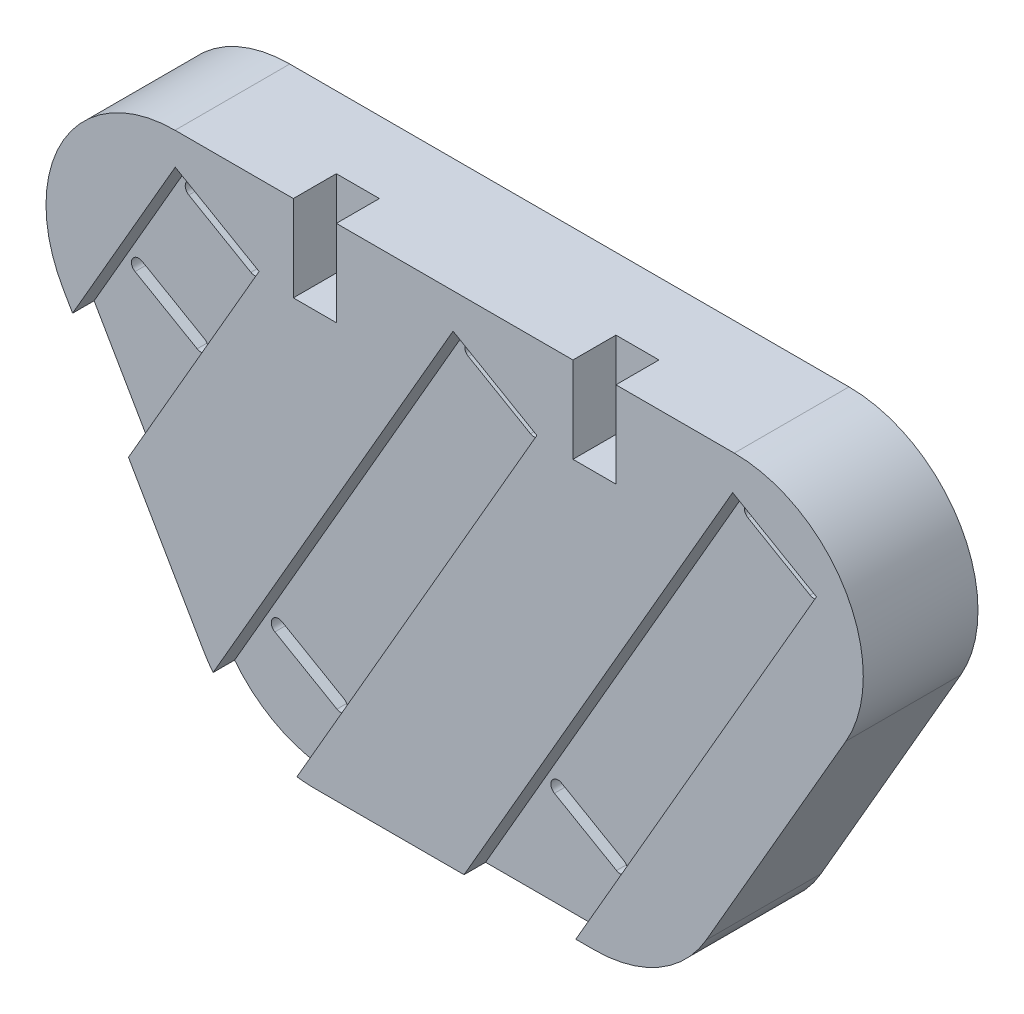
from build123d import *

# Parameters (mm, degrees)
SKETCH1_R           = 7.5
BOSS_EXTRUDE1_DEPTH = 5
SKETCH2_R           = 7.5
BOSS_EXTRUDE2_DEPTH = 1.5
BOSS_EXTRUDE3_DEPTH = 1.5
SKETCH9_W           = 3
SKETCH9_H           = 6
CUT_EXTRUDE4_DEPTH  = 3
SKETCH4_W           = 5
SKETCH4_H           = 1.5
CUT_EXTRUDE5_DEPTH  = 3


with BuildPart() as part:
    # Sketch1 → Boss-Extrude1 (new body)
    with BuildSketch(Plane.XY):
        with BuildLine():
            Line((7.794228634, -4.5), (-1.955771366, -21.387495374))
            ThreePointArc((-1.955771366, -21.387495374), (-5.25, -24.681724008), (-9.75, -25.887495374))
            Line((-9.75, -25.887495374), (-29.25, -25.887495374))
            ThreePointArc((-29.25, -25.887495374), (-33.75, -24.681724008), (-37.044228634, -21.387495374))
            Line((-37.044228634, -21.387495374), (-46.794228634, -4.5))
            ThreePointArc((-46.794228634, -4.5), (-46.794228634, 4.5), (-39, 9))
            Line((-39, 9), (0, 9))
            ThreePointArc((0, 9), (7.794228634, 4.5), (7.794228634, -4.5))
        make_face()
        with Locations((-29.25, -16.887495374)):
            Circle(SKETCH1_R, mode=Mode.SUBTRACT)
        with Locations((-19.5, 0)):
            Circle(SKETCH1_R, mode=Mode.SUBTRACT)
        Circle(SKETCH1_R, mode=Mode.SUBTRACT)
        with Locations((-9.75, -16.887495374)):
            Circle(SKETCH1_R, mode=Mode.SUBTRACT)
        with Locations((-39, 0)):
            Circle(SKETCH1_R, mode=Mode.SUBTRACT)
    extrude(amount=BOSS_EXTRUDE1_DEPTH)

    # Sketch2 → Boss-Extrude2 (add)
    # profile 1 of 6: a face of its own
    with BuildSketch(Plane.XY.offset(5)):
        with BuildLine():
            Line((-1.955771366, -21.387495374), (7.794228634, -4.5))
            ThreePointArc((7.794228634, -4.5), (7.794228634, 4.5), (0, 9))
            Line((0, 9), (-39, 9))
            ThreePointArc((-39, 9), (-46.794228634, 4.5), (-46.794228634, -4.5))
            Line((-46.794228634, -4.5), (-37.044228634, -21.387495374))
            ThreePointArc((-37.044228634, -21.387495374), (-33.75, -24.681724008), (-29.25, -25.887495374))
            Line((-29.25, -25.887495374), (-9.75, -25.887495374))
            ThreePointArc((-9.75, -25.887495374), (-5.25, -24.681724008), (-1.955771366, -21.387495374))
        make_face()
        Circle(SKETCH2_R, mode=Mode.SUBTRACT)
        with Locations((-19.5, 0)):
            Circle(SKETCH2_R, mode=Mode.SUBTRACT)
        with Locations((-39, 0)):
            Circle(SKETCH2_R, mode=Mode.SUBTRACT)
        with Locations((-29.25, -16.887495374)):
            Circle(SKETCH2_R, mode=Mode.SUBTRACT)
        with Locations((-9.75, -16.887495374)):
            Circle(SKETCH2_R, mode=Mode.SUBTRACT)
    # profile 2 of 6: a face of its own
    with BuildSketch(Plane.XY.offset(5)):
        with Locations((-9.75, -16.887495374)):
            Circle(SKETCH2_R)
        with BuildLine():
            ThreePointArc((-13.540063509, -18.452077936), (-14.223076211, -18.635090638), (-14.040063509, -19.31810334))
            Line((-14.040063509, -19.31810334), (-9.709936491, -21.81810334))
            ThreePointArc((-9.709936491, -21.81810334), (-9.026923789, -21.635090638), (-9.209936491, -20.952077936))
            Line((-9.209936491, -20.952077936), (-13.540063509, -18.452077936))
        make_face(mode=Mode.SUBTRACT)
    # profile 3 of 6: a face of its own
    with BuildSketch(Plane.XY.offset(5)):
        Circle(SKETCH2_R)
        with BuildLine():
            ThreePointArc((-0.040063509, 4.930607966), (-0.723076211, 4.747595264), (-0.540063509, 4.064582562))
            Line((-0.540063509, 4.064582562), (3.790063509, 1.564582562))
            ThreePointArc((3.790063509, 1.564582562), (4.473076211, 1.747595264), (4.290063509, 2.430607966))
            Line((4.290063509, 2.430607966), (-0.040063509, 4.930607966))
        make_face(mode=Mode.SUBTRACT)
    # profile 4 of 6: a face of its own
    with BuildSketch(Plane.XY.offset(5)):
        with Locations((-19.5, 0)):
            Circle(SKETCH2_R)
        with BuildLine():
            ThreePointArc((-19.540063509, 4.930607966), (-20.223076211, 4.747595264), (-20.040063509, 4.064582562))
            Line((-20.040063509, 4.064582562), (-15.709936491, 1.564582562))
            ThreePointArc((-15.709936491, 1.564582562), (-15.026923789, 1.747595264), (-15.209936491, 2.430607966))
            Line((-15.209936491, 2.430607966), (-19.540063509, 4.930607966))
        make_face(mode=Mode.SUBTRACT)
    # profile 5 of 6: a face of its own
    with BuildSketch(Plane.XY.offset(5)):
        with Locations((-29.25, -16.887495374)):
            Circle(SKETCH2_R)
        with BuildLine():
            ThreePointArc((-33.040063509, -18.452077936), (-33.723076211, -18.635090638), (-33.540063509, -19.31810334))
            Line((-33.540063509, -19.31810334), (-29.209936491, -21.81810334))
            ThreePointArc((-29.209936491, -21.81810334), (-28.526923789, -21.635090638), (-28.709936491, -20.952077936))
            Line((-28.709936491, -20.952077936), (-33.040063509, -18.452077936))
        make_face(mode=Mode.SUBTRACT)
    # profile 6 of 6: a face of its own
    with BuildSketch(Plane.XY.offset(5)):
        with Locations((-39, 0)):
            Circle(SKETCH2_R)
        with BuildLine():
            ThreePointArc((-42.790063509, -1.564582562), (-43.473076211, -1.747595264), (-43.290063509, -2.430607966))
            Line((-43.290063509, -2.430607966), (-38.959936491, -4.930607966))
            ThreePointArc((-38.959936491, -4.930607966), (-38.276923789, -4.747595264), (-38.459936491, -4.064582562))
            Line((-38.459936491, -4.064582562), (-42.790063509, -1.564582562))
        make_face(mode=Mode.SUBTRACT)
        with BuildLine():
            ThreePointArc((-39.040063509, 4.930607966), (-39.723076211, 4.747595264), (-39.540063509, 4.064582562))
            Line((-39.540063509, 4.064582562), (-35.209936491, 1.564582562))
            ThreePointArc((-35.209936491, 1.564582562), (-34.526923789, 1.747595264), (-34.709936491, 2.430607966))
            Line((-34.709936491, 2.430607966), (-39.040063509, 4.930607966))
        make_face(mode=Mode.SUBTRACT)
    extrude(amount=BOSS_EXTRUDE2_DEPTH)

    # Sketch3 → Boss-Extrude3 (add)
    with BuildSketch(Plane.XY.offset(6.5)):
        with BuildLine():
            ThreePointArc((-39, 9), (-46.794228634, 4.5), (-46.794228634, -4.5))
            Line((-46.794228634, -4.5), (-46.144709581, -5.625))
            Line((-46.144709581, -5.625), (-38.985335738, 6.775399247))
            Line((-38.985335738, 6.775399247), (-33.139664262, 3.400399247))
            Line((-33.139664262, 3.400399247), (-42.247595264, -12.375))
            Line((-42.247595264, -12.375), (-37.044228634, -21.387495374))
            ThreePointArc((-37.044228634, -21.387495374), (-36.712405778, -21.918648323), (-36.344447387, -22.425438699))
            Line((-36.344447387, -22.425438699), (-34.985335738, -20.07138827))
            Line((-34.985335738, -20.07138827), (-19.610335738, 6.558892896))
            Line((-19.610335738, 6.558892896), (-13.764664262, 3.183892896))
            Line((-13.764664262, 3.183892896), (-29.139664262, -23.44638827))
            Line((-29.139664262, -23.44638827), (-30.498775911, -25.800438699))
            ThreePointArc((-30.498775911, -25.800438699), (-29.875903375, -25.865704826), (-29.25, -25.887495374))
            Line((-29.25, -25.887495374), (-18.84326674, -25.887495374))
            Line((-18.84326674, -25.887495374), (-15.485335738, -20.07138827))
            Line((-15.485335738, -20.07138827), (-0.110335738, 6.558892896))
            Line((-0.110335738, 6.558892896), (5.735335738, 3.183892896))
            Line((5.735335738, 3.183892896), (-9.639664262, -23.44638827))
            Line((-9.639664262, -23.44638827), (-11.049038106, -25.887495374))
            Line((-11.049038106, -25.887495374), (-9.75, -25.887495374))
            ThreePointArc((-9.75, -25.887495374), (-5.25, -24.681724008), (-1.955771366, -21.387495374))
            Line((-1.955771366, -21.387495374), (7.794228634, -4.5))
            ThreePointArc((7.794228634, -4.5), (7.794228634, 4.5), (0, 9))
            Line((0, 9), (-39, 9))
        make_face()
    extrude(amount=BOSS_EXTRUDE3_DEPTH)

    # Sketch9 → Cut-Extrude4 (cut)
    with BuildSketch(Plane.XY.offset(8)):
        with Locations((-29.25, 6)):
            Rectangle(SKETCH9_W, SKETCH9_H)
        with Locations((-9.75, 6)):
            Rectangle(SKETCH9_W, SKETCH9_H)
    extrude(amount=-CUT_EXTRUDE4_DEPTH, mode=Mode.SUBTRACT)

    # Sketch4 → Cut-Extrude5 (cut)
    with BuildSketch(Plane(origin=(0, 0, 0), x_dir=(-1, 0, 0), z_dir=(0, 0, -1))):
        Polygon((-2.870190528, -10.028684177), (-0.370190528, -14.358811196), (0.928847577, -13.608811196), (-1.571152423, -9.278684177), align=None)
        with Locations((9.75, 6.75)):
            Rectangle(SKETCH4_W, SKETCH4_H)
        with Locations((29.25, 6.75)):
            Rectangle(SKETCH4_W, SKETCH4_H)
        Polygon((39.370190528, -14.358811196), (41.870190528, -10.028684177), (40.571152423, -9.278684177), (38.071152423, -13.608811196), align=None)
        with Locations((19.5, -23.637495374)):
            Rectangle(SKETCH4_W, SKETCH4_H)
    extrude(amount=-CUT_EXTRUDE5_DEPTH, mode=Mode.SUBTRACT)


solid = part.part
